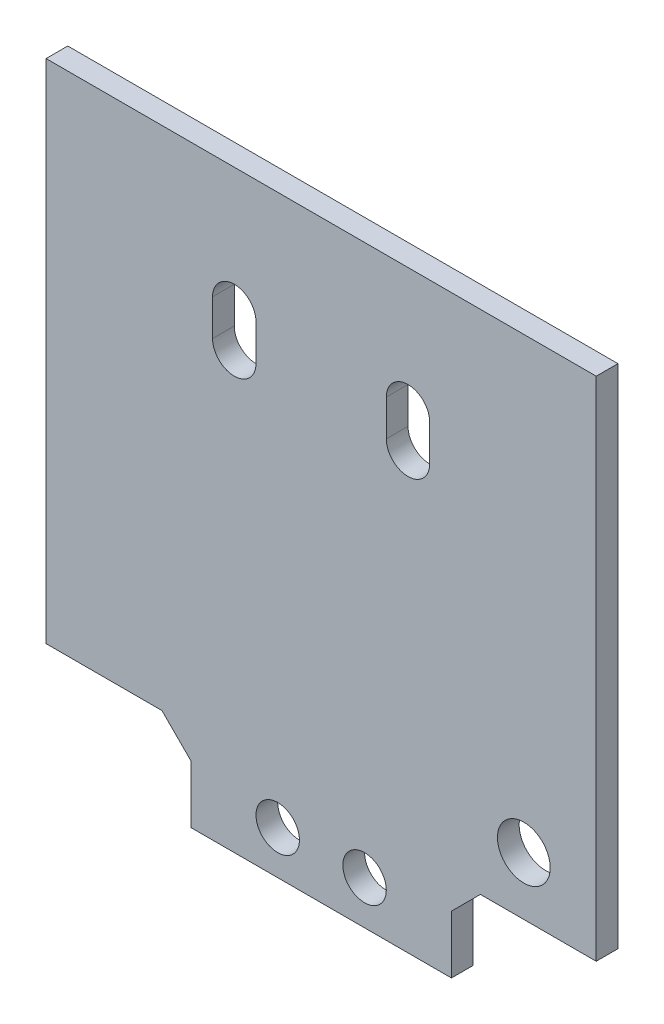
from build123d import *

# Parameters (mm, degrees)
SZKIC1_R                    = 1.5
SZKIC1_R_2                  = 1.822392888
DODANIE_WYCI_GNI_CIE1_DEPTH = 1.5
SFAZOWANIE1_SIZE            = 2


with BuildPart() as part:
    # Szkic1 → Dodanie-wyciągnięcie1 (new body)
    with BuildSketch(Plane.XY):
        Polygon((0, 0), (38, 0), (38, -35), (31.060112688, -35), (28, -35), (28, -40.397059959), (28, -41), (10, -41), (10, -40.699902364), (10, -35), (5.889298893, -35), (0, -35), align=None)
        with Locations((16, -38)):
            Circle(SZKIC1_R, mode=Mode.SUBTRACT)
        with Locations((22, -38)):
            Circle(SZKIC1_R, mode=Mode.SUBTRACT)
        with Locations((33, -31)):
            Circle(SZKIC1_R_2, mode=Mode.SUBTRACT)
        with BuildLine():
            Line((26.5, -8.5), (26.5, -11))
            ThreePointArc((26.5, -11), (25, -12.5), (23.5, -11))
            Line((23.5, -11), (23.5, -8.5))
            ThreePointArc((23.5, -8.5), (25, -7), (26.5, -8.5))
        make_face(mode=Mode.SUBTRACT)
        with BuildLine():
            Line((11.5, -8.5), (11.5, -11))
            ThreePointArc((11.5, -11), (13, -12.5), (14.5, -11))
            Line((14.5, -11), (14.5, -8.5))
            ThreePointArc((14.5, -8.5), (13, -7), (11.5, -8.5))
        make_face(mode=Mode.SUBTRACT)
    extrude(amount=DODANIE_WYCI_GNI_CIE1_DEPTH)

    # Sfazowanie1
    sfazowanie1_edges = [part.edges().sort_by_distance(p)[0] for p in [
        (28, -35, 0.75),
        (10, -35, 0.75),
    ]]
    chamfer(sfazowanie1_edges, length=SFAZOWANIE1_SIZE)


solid = part.part
